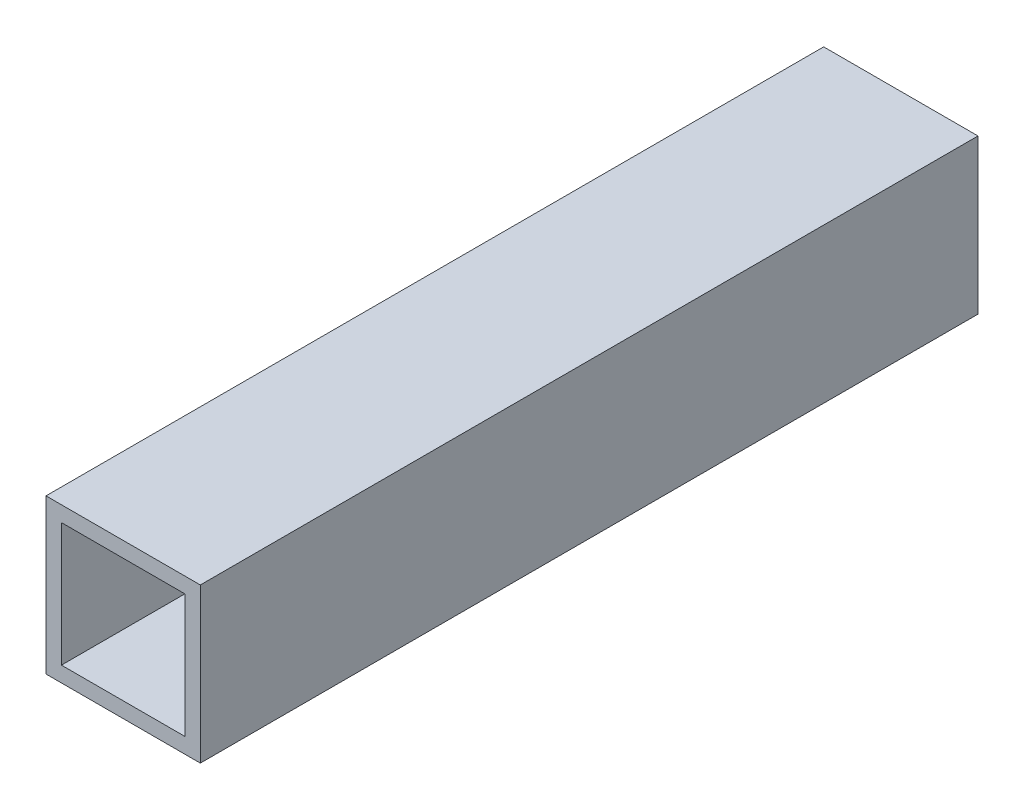
from build123d import *

# Parameters (mm, degrees)
SKETCH1_W           = 3.96875
SKETCH1_H           = 3.96875
BOSS_EXTRUDE1_DEPTH = 10
SKETCH2_W           = 3.175
SKETCH2_H           = 3.175
CUT_EXTRUDE1_DEPTH  = 21.195927517


with BuildPart() as part:
    # Sketch1 → Boss-Extrude1 (new, symmetric)
    with BuildSketch(Plane.XY):
        Rectangle(SKETCH1_W, SKETCH1_H)
    extrude(amount=BOSS_EXTRUDE1_DEPTH, both=True)

    # Sketch2 → Cut-Extrude1 (cut, through all)
    with BuildSketch(Plane.XY.offset(10)):
        Rectangle(SKETCH2_W, SKETCH2_H)
    extrude(amount=-CUT_EXTRUDE1_DEPTH, mode=Mode.SUBTRACT)


solid = part.part
